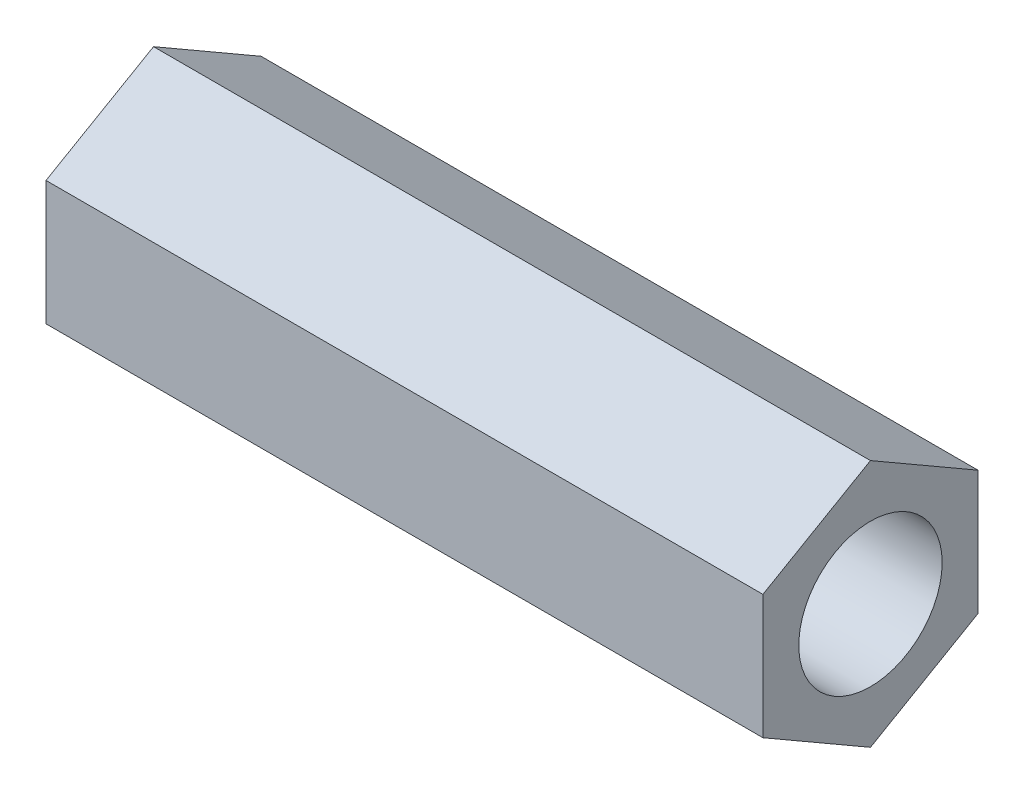
from build123d import *

# Parameters (mm, degrees)
SKETCH_1_R      = 2
EXTRUDE_1_DEPTH = 20


with BuildPart() as part:
    # 草图1 → 凸台-拉伸1 (new body)
    with BuildSketch(Plane(origin=(0, 0, 0), x_dir=(0, 0, -1), z_dir=(1, 0, 0))):
        Polygon((0, 3.464101615), (-3, 1.732050808), (-3, -1.732050808), (0, -3.464101615), (3, -1.732050808), (3, 1.732050808), align=None)
        Circle(SKETCH_1_R, mode=Mode.SUBTRACT)
    extrude(amount=EXTRUDE_1_DEPTH)


solid = part.part
